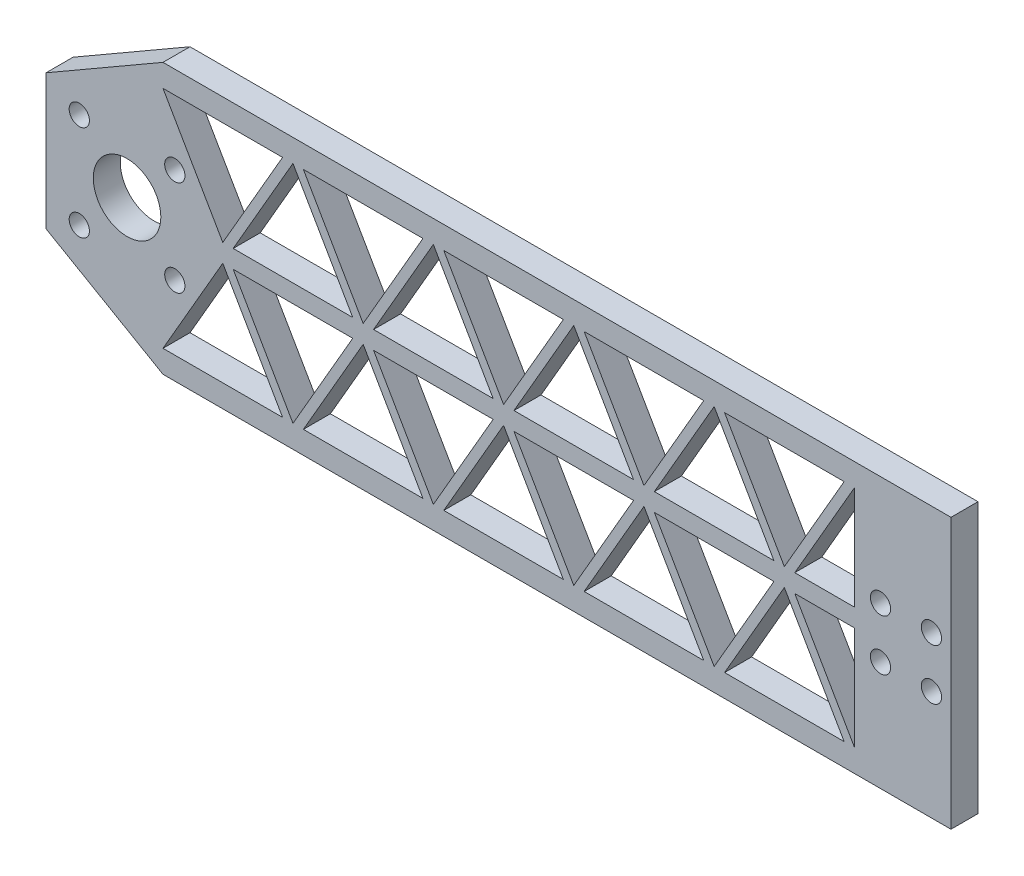
from build123d import *

# Parameters (mm, degrees)
BOSS_EXTRUDE1_DEPTH = 6
CUT_EXTRUDE3_DEPTH  = 132.727049709
HOLE1_D             = 15
HOLE3_D             = 4.5
HOLE4_D             = 4.5


with BuildPart() as part:
    # Sketch1 → Boss-Extrude1 (new body)
    with BuildSketch(Plane(origin=(0, 0, 0), x_dir=(0, 1, 0), z_dir=(0, 0, 1))):
        Polygon((-30, 46.875), (-30, -128.125), (30, -128.125), (30, 46.875), (15, 72.855762114), (-15, 72.855762114), align=None)
    extrude(amount=BOSS_EXTRUDE1_DEPTH)

    # Sketch2 → Cut-Extrude3 (cut, through all)
    with BuildSketch(Plane.XY.offset(6)):
        Polygon((-31.286542732, 2), (-4.728430349, 2), (-18.007486541, 25), align=None)
        Polygon((106.709427996, -25), (93.430371804, -2), (106.709427996, -2), align=None)
        Polygon((-15.698085464, 25), (10.860026919, 25), (-2.419029272, 2), align=None)
        Polygon((106.709427996, 25), (106.709427996, 2), (93.430371804, 2), align=None)
        Polygon((-0.109628196, 2), (26.448484187, 2), (13.169427996, 25), align=None)
        Polygon((-46.875, 25), (-33.595943809, 2), (-20.316887617, 25), align=None)
        Polygon((15.481914536, 25), (28.760970728, 2), (42.040026919, 25), align=None)
        Polygon((44.349427996, 25), (31.070371804, 2), (57.628484187, 2), align=None)
        Polygon((46.661914536, 25), (59.940970728, 2), (73.220026919, 25), align=None)
        Polygon((75.529427996, 25), (62.250371804, 2), (88.808484187, 2), align=None)
        Polygon((77.841914536, 25), (91.120970728, 2), (104.400026919, 25), align=None)
        Polygon((77.841914536, -25), (91.120970728, -2), (104.400026919, -25), align=None)
        Polygon((75.529427996, -25), (62.250371804, -2), (88.808484187, -2), align=None)
        Polygon((46.661914536, -25), (59.940970728, -2), (73.220026919, -25), align=None)
        Polygon((44.349427996, -25), (31.070371804, -2), (57.628484187, -2), align=None)
        Polygon((15.481914536, -25), (28.760970728, -2), (42.040026919, -25), align=None)
        Polygon((13.169427996, -25), (-0.109628196, -2), (26.448484187, -2), align=None)
        Polygon((-15.698085464, -25), (-2.419029272, -2), (10.860026919, -25), align=None)
        Polygon((-18.007486541, -25), (-4.728430349, -2), (-31.286542732, -2), align=None)
        Polygon((-46.875, -25), (-33.595943809, -2), (-20.316887617, -25), align=None)
    extrude(amount=-CUT_EXTRUDE3_DEPTH, mode=Mode.SUBTRACT)

    # Hole1 (through all)
    with Locations(Plane(origin=(-54.855762114, 0, 6), x_dir=(1, 0, 0), z_dir=(0, 0, 1))):
        with Locations((0, 0)):
            Hole(HOLE1_D / 2)

    # Hole3 (through all)
    with Locations(Plane(origin=(-65.462363831, -10.606601718, 6), x_dir=(1, 0, 0), z_dir=(0, 0, 1))):
        with Locations((0, 0), (21.213203435, 0), (0, 21.213203436), (21.213203435, 21.213203436)):
            Hole(HOLE3_D / 2)

    # Hole4 (through all)
    with Locations(Plane(origin=(123.781854249, 5.656854249, 6), x_dir=(1, 0, 0), z_dir=(0, 0, 1))):
        with Locations((0, 0), (0, -11.313708498), (-11.313708498, -11.313708498), (-11.313708498, 0)):
            Hole(HOLE4_D / 2)


solid = part.part
